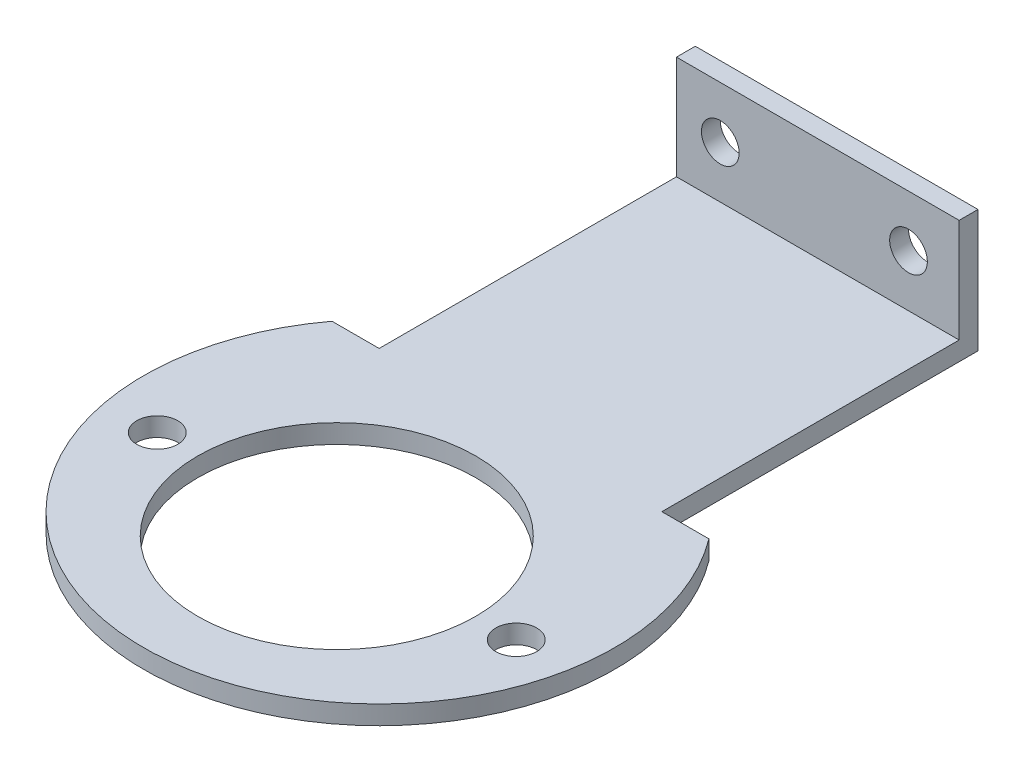
from build123d import *

# Parameters (mm, degrees)
BOSS_EXTRUDE1_DEPTH = 4
SKETCH2_R           = 4.35
CUT_EXTRUDE1_DEPTH  = 4
SKETCH8_W           = 60
SKETCH8_H           = 4
BOSS_EXTRUDE4_DEPTH = 67.1
SKETCH10_W          = 60
SKETCH10_H          = 4
BOSS_EXTRUDE6_DEPTH = 22
SKETCH11_R          = 4
CUT_EXTRUDE2_DEPTH  = 20
SKETCH12_R          = 29.5
CUT_EXTRUDE3_DEPTH  = 10


with BuildPart() as part:
    # Sketch1 → Boss-Extrude1 (new body)
    with BuildSketch(Plane(origin=(0, 0, 0), x_dir=(1, 0, 0), z_dir=(0, 1, 0))):
        with BuildLine():
            Line((-40, 30), (40, 30))
            ThreePointArc((40, 30), (47.434164903, 15.811388301), (50, 0))
            ThreePointArc((50, 0), (0, -50), (-50, 0))
            ThreePointArc((-50, 0), (-47.434164903, 15.811388301), (-40, 30))
        make_face()
    extrude(amount=BOSS_EXTRUDE1_DEPTH)

    # Sketch2 → Cut-Extrude1 (cut)
    with BuildSketch(Plane(origin=(0, 4, 0), x_dir=(1, 0, 0), z_dir=(0, 1, 0))):
        with Locations(Location((-38.1, -9, 0), (0, 0, 270))):
            Circle(SKETCH2_R)
        with Locations(Location((38.1, -9, 0), (0, 0, 270))):
            Circle(SKETCH2_R)
    extrude(amount=-CUT_EXTRUDE1_DEPTH, mode=Mode.SUBTRACT)

    # Sketch8 → Boss-Extrude4 (add)
    with BuildSketch(Plane(origin=(0, 0, -30), x_dir=(-1, 0, 0), z_dir=(0, 0, -1))):
        with Locations((0, 2)):
            Rectangle(SKETCH8_W, SKETCH8_H)
    extrude(amount=BOSS_EXTRUDE4_DEPTH)

    # Sketch10 → Boss-Extrude6 (add)
    with BuildSketch(Plane(origin=(0, 4, 0), x_dir=(1, 0, 0), z_dir=(0, 1, 0))):
        with Locations((0, 95.1)):
            Rectangle(SKETCH10_W, SKETCH10_H)
    extrude(amount=BOSS_EXTRUDE6_DEPTH)

    # Sketch11 → Cut-Extrude2 (cut)
    with BuildSketch(Plane(origin=(0, 0, -97.1), x_dir=(-1, 0, 0), z_dir=(0, 0, -1))):
        with Locations((-19.25, 15)):
            Circle(SKETCH11_R)
        with Locations((20.7, 15)):
            Circle(SKETCH11_R)
    extrude(amount=-CUT_EXTRUDE2_DEPTH, mode=Mode.SUBTRACT)

    # Sketch12 → Cut-Extrude3 (cut)
    with BuildSketch(Plane(origin=(0, 4, 0), x_dir=(1, 0, 0), z_dir=(0, 1, 0))):
        with Locations(Location((0, -9, 0), (0, 0, 270))):
            Circle(SKETCH12_R)
    extrude(amount=-CUT_EXTRUDE3_DEPTH, mode=Mode.SUBTRACT)


solid = part.part
